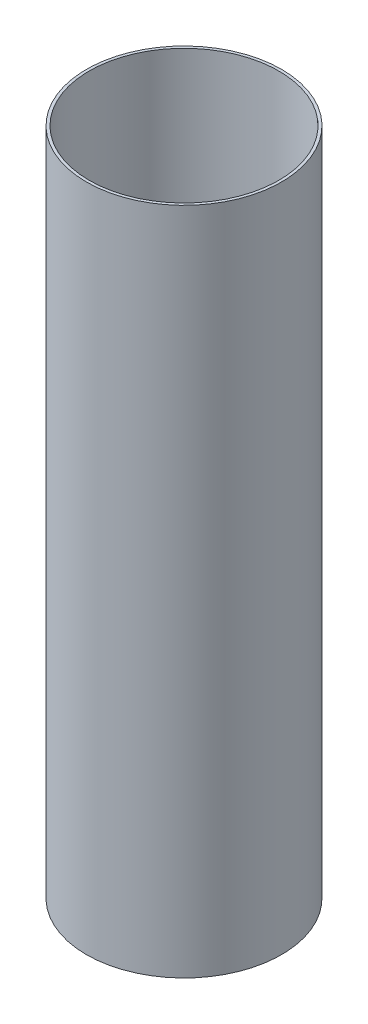
from build123d import *

# Parameters (mm, degrees)
SKETCH1_R           = 17.5
SKETCH1_R_2         = 17
BOSS_EXTRUDE1_DEPTH = 60


with BuildPart() as part:
    # Sketch1 → Boss-Extrude1 (new, symmetric)
    with BuildSketch(Plane(origin=(0, 0, 0), x_dir=(1, 0, 0), z_dir=(0, 1, 0))):
        with Locations(Location((0, 0, 0), (0, 0, 270))):
            Circle(SKETCH1_R)
        with Locations(Location((0, 0, 0), (0, 0, 270))):
            Circle(SKETCH1_R_2, mode=Mode.SUBTRACT)
    extrude(amount=BOSS_EXTRUDE1_DEPTH, both=True)


solid = part.part
